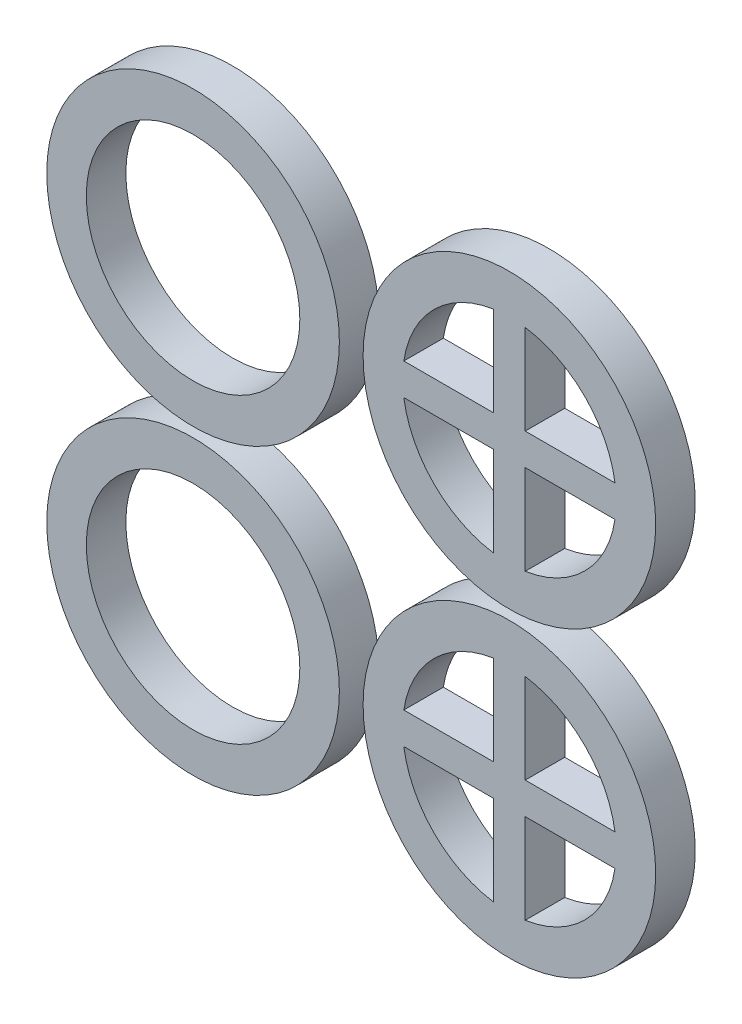
from build123d import *

# Parameters (mm, degrees)
SKETCH1_R             = 18.5
SKETCH1_R_2           = 13.5
BOSS_EXTRUDE1_DEPTH   = 5
BOSS_EXTRUDE1_2_DEPTH = 5
BOSS_EXTRUDE1_3_DEPTH = 5
BOSS_EXTRUDE1_4_DEPTH = 5


with BuildPart() as part:
    # Sketch1 → Boss-Extrude1 (new body)
    with BuildSketch(Plane.XY):
        Circle(SKETCH1_R)
        Circle(SKETCH1_R_2, mode=Mode.SUBTRACT)
    extrude(amount=BOSS_EXTRUDE1_DEPTH)


with BuildPart() as body_2:
    # Sketch1 → Boss-Extrude1 2 (new body)
    with BuildSketch(Plane.XY):
        with Locations((40, 0)):
            Circle(SKETCH1_R)
        with BuildLine():
            Line((38, 13.351029923), (38, 2))
            Line((38, 2), (26.648970077, 2))
            ThreePointArc((26.648970077, 2), (30.454058454, 9.545941546), (38, 13.351029923))
        make_face(mode=Mode.SUBTRACT)
        with BuildLine():
            Line((26.648970077, -2), (38, -2))
            Line((38, -2), (38, -13.351029923))
            ThreePointArc((38, -13.351029923), (30.454058454, -9.545941546), (26.648970077, -2))
        make_face(mode=Mode.SUBTRACT)
        with BuildLine():
            Line((42, 13.351029923), (42, 2))
            Line((42, 2), (53.351029923, 2))
            ThreePointArc((53.351029923, 2), (49.545941546, 9.545941546), (42, 13.351029923))
        make_face(mode=Mode.SUBTRACT)
        with BuildLine():
            Line((42, -2), (42, -13.351029923))
            ThreePointArc((42, -13.351029923), (49.545941546, -9.545941546), (53.351029923, -2))
            Line((53.351029923, -2), (42, -2))
        make_face(mode=Mode.SUBTRACT)
    extrude(amount=BOSS_EXTRUDE1_2_DEPTH)


with BuildPart() as body_3:
    # Sketch1 → Boss-Extrude1 3 (new body)
    with BuildSketch(Plane.XY):
        with Locations((0, -38.218276901)):
            Circle(SKETCH1_R)
        with Locations((0, -38.218276901)):
            Circle(SKETCH1_R_2, mode=Mode.SUBTRACT)
    extrude(amount=BOSS_EXTRUDE1_3_DEPTH)


with BuildPart() as body_4:
    # Sketch1 → Boss-Extrude1 4 (new body)
    with BuildSketch(Plane.XY):
        with Locations((40, -38.218276901)):
            Circle(SKETCH1_R)
        with BuildLine():
            Line((26.648970077, -36.218276901), (38, -36.218276901))
            Line((38, -36.218276901), (38, -24.867246978))
            ThreePointArc((38, -24.867246978), (30.454058454, -28.672335355), (26.648970077, -36.218276901))
        make_face(mode=Mode.SUBTRACT)
        with BuildLine():
            Line((38, -40.218276901), (38, -51.569306824))
            ThreePointArc((38, -51.569306824), (30.454058454, -47.764218447), (26.648970077, -40.218276901))
            Line((26.648970077, -40.218276901), (38, -40.218276901))
        make_face(mode=Mode.SUBTRACT)
        with BuildLine():
            Line((42, -40.218276901), (53.351029923, -40.218276901))
            ThreePointArc((53.351029923, -40.218276901), (49.545941546, -47.764218447), (42, -51.569306824))
            Line((42, -51.569306824), (42, -40.218276901))
        make_face(mode=Mode.SUBTRACT)
        with BuildLine():
            Line((42, -36.218276901), (53.351029923, -36.218276901))
            ThreePointArc((53.351029923, -36.218276901), (49.545941546, -28.672335355), (42, -24.867246978))
            Line((42, -24.867246978), (42, -36.218276901))
        make_face(mode=Mode.SUBTRACT)
    extrude(amount=BOSS_EXTRUDE1_4_DEPTH)


solid = Compound([part.part, body_2.part, body_3.part, body_4.part])
